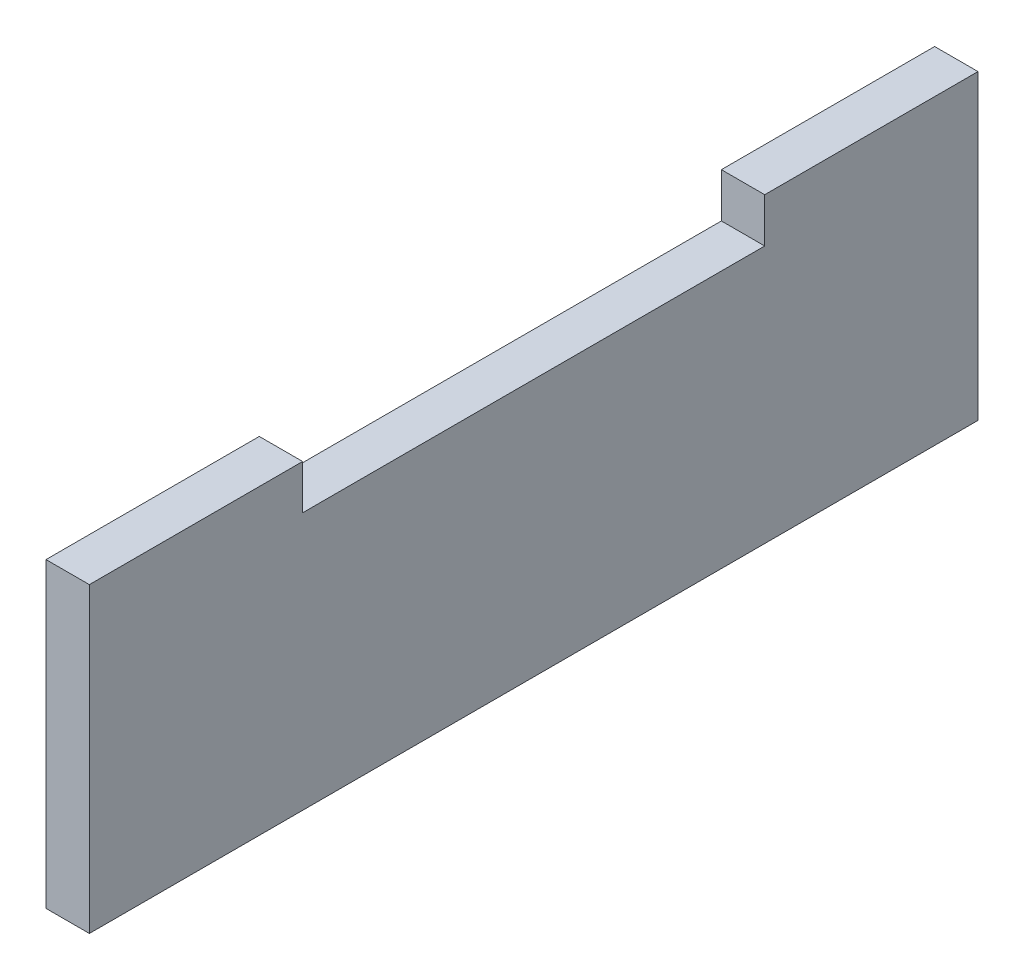
from build123d import *

# Parameters (mm, degrees)
BOSS_EXTRUDE1_DEPTH = 12.2


with BuildPart() as part:
    # Sketch1 → Boss-Extrude1 (new body)
    with BuildSketch(Plane(origin=(0, 0, 0), x_dir=(0, 0, -1), z_dir=(1, 0, 0))):
        Polygon((-65, 42.5), (-125, 42.5), (-125, -42.5), (125, -42.5), (125, 42.5), (65, 42.5), (65, 30), (-65, 30), align=None)
    extrude(amount=BOSS_EXTRUDE1_DEPTH)


solid = part.part
